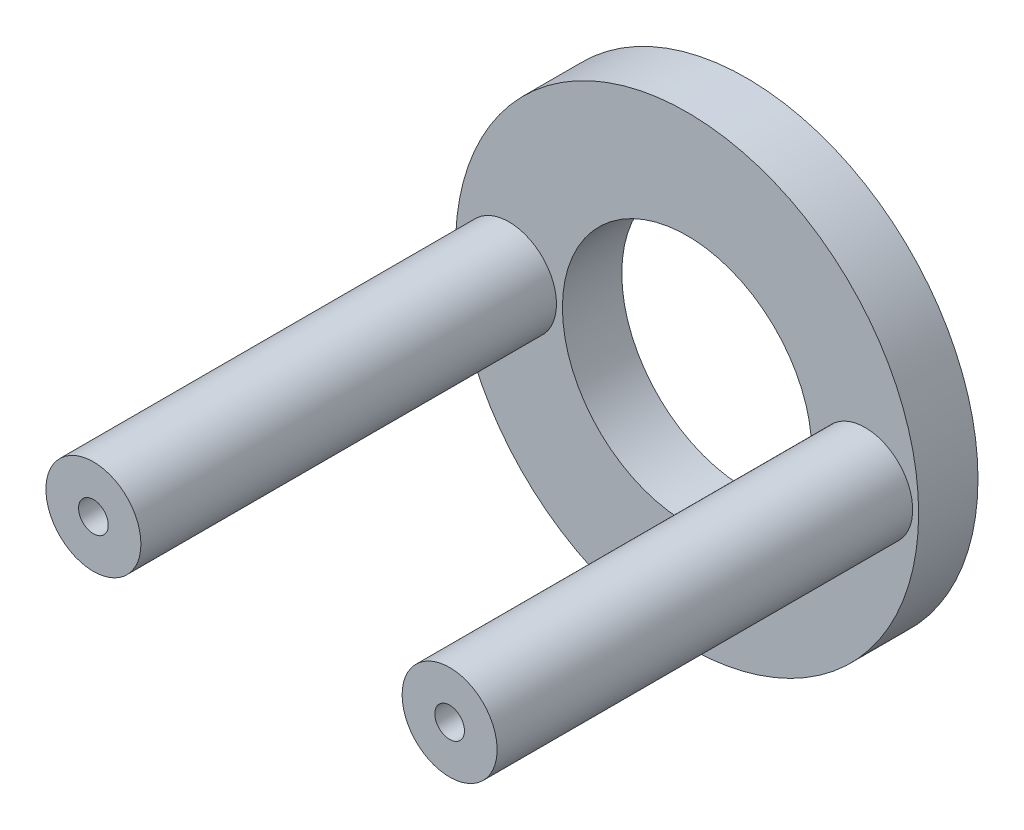
from build123d import *

# Parameters (mm, degrees)
SKETCH1_R           = 19.5
SKETCH1_R_2         = 10.5
BOSS_EXTRUDE1_DEPTH = 5
SKETCH3_R           = 4
BOSS_EXTRUDE2_DEPTH = 35
SKETCH4_R           = 1.25
CUT_EXTRUDE1_DEPTH  = 7


with BuildPart() as part:
    # Sketch1 → Boss-Extrude1 (new body)
    with BuildSketch(Plane.XY):
        Circle(SKETCH1_R)
        Circle(SKETCH1_R_2, mode=Mode.SUBTRACT)
    extrude(amount=BOSS_EXTRUDE1_DEPTH)

    # Sketch3 → Boss-Extrude2 (add)
    with BuildSketch(Plane.XY.offset(5)):
        with Locations((-15, 0)):
            Circle(SKETCH3_R)
        with Locations(Location((15, 0, 0), (0, 0, 180))):
            Circle(SKETCH3_R)
    extrude(amount=BOSS_EXTRUDE2_DEPTH)

    # Sketch4 → Cut-Extrude1 (cut)
    with BuildSketch(Plane.XY.offset(40)):
        with Locations((15, 0)):
            Circle(SKETCH4_R)
        with Locations((-15, 0)):
            Circle(SKETCH4_R)
    extrude(amount=-CUT_EXTRUDE1_DEPTH, mode=Mode.SUBTRACT)


solid = part.part
